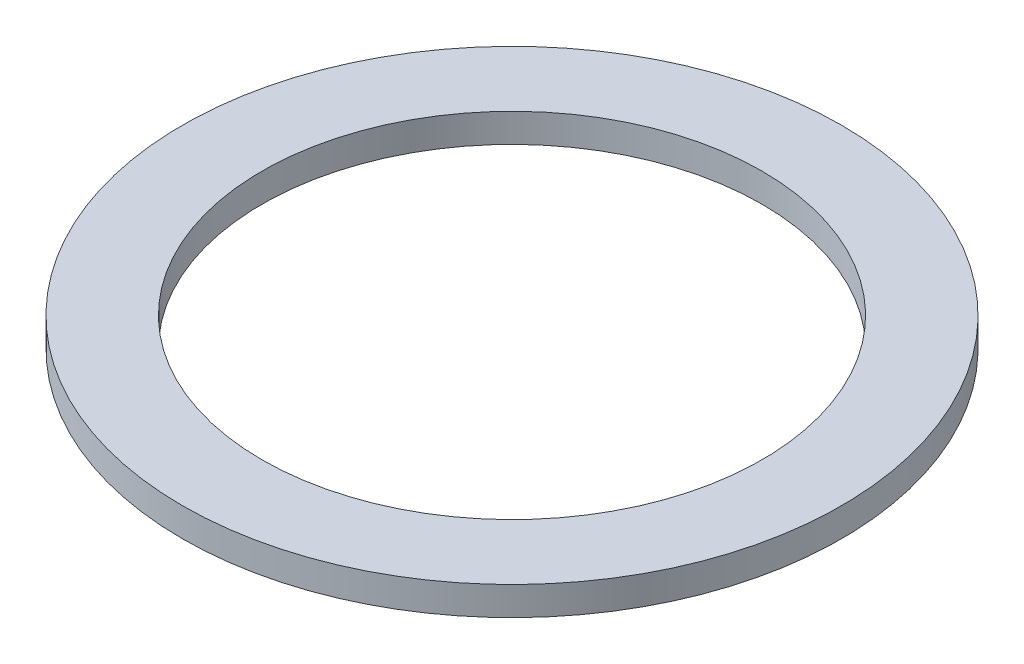
from build123d import *

# Parameters (mm, degrees)
SKETCH1_R           = 24.12
SKETCH1_R_2         = 18.3
BOSS_EXTRUDE1_DEPTH = 2.1


with BuildPart() as part:
    # Sketch1 → Boss-Extrude1 (new body)
    with BuildSketch(Plane(origin=(0, 0, 0), x_dir=(1, 0, 0), z_dir=(0, 1, 0))):
        with Locations(Location((0, 0, 0), (0, 0, 270))):
            Circle(SKETCH1_R)
        with Locations(Location((0, 0, 0), (0, 0, 270))):
            Circle(SKETCH1_R_2, mode=Mode.SUBTRACT)
    extrude(amount=BOSS_EXTRUDE1_DEPTH)


solid = part.part
